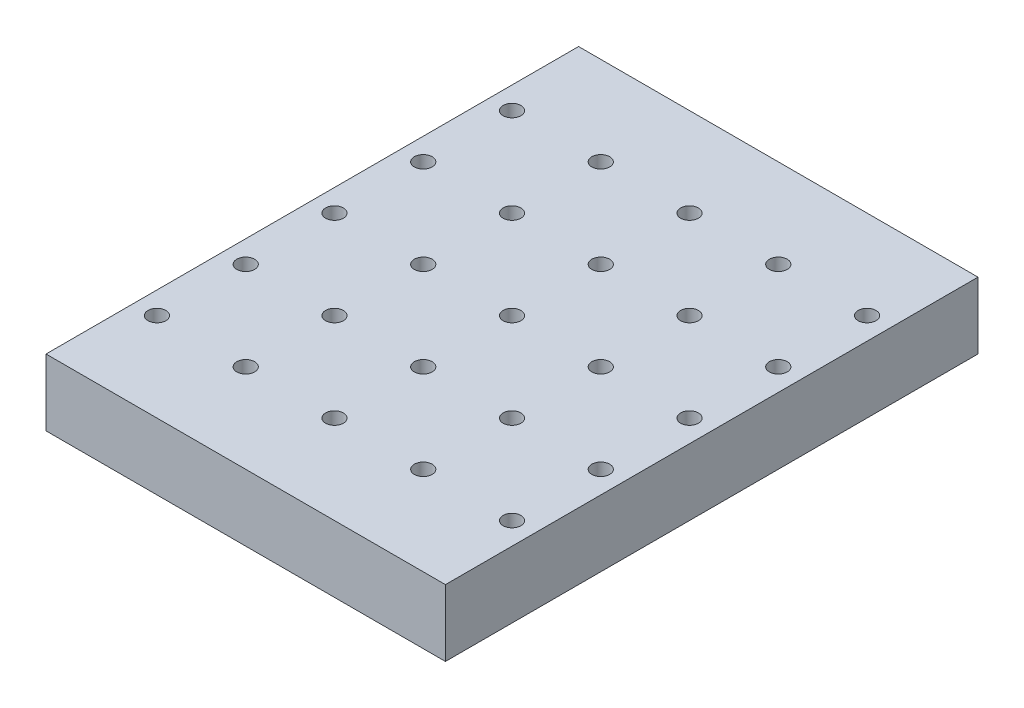
from build123d import *

# Parameters (mm, degrees)
SKETCH1_W               = 114.3
SKETCH1_H               = 152.4
BOSS_EXTRUDE1_DEPTH     = 19.05
F_1_4_20_TAPPED_HOLE1_D = 5.1054
LPATTERN1_COUNT         = 3
LPATTERN1_PITCH         = 25.4
LPATTERN1_COL_COUNT     = 3
LPATTERN1_COL_PITCH     = 25.4
LPATTERN2_COUNT         = 3
LPATTERN2_PITCH         = 25.4
LPATTERN2_COPY_1_D      = 5.1054
LPATTERN2_COPY_2_D      = 5.1054
LPATTERN2_COPY_3_D      = 5.1054
LPATTERN2_COPY_4_D      = 5.1054
LPATTERN2_COPY_5_D      = 5.1054
LPATTERN2_COPY_6_D      = 5.1054
LPATTERN2_COPY_7_D      = 5.1054
LPATTERN2_COPY_8_D      = 5.1054
LPATTERN2_COL_COUNT     = 3
LPATTERN2_COL_PITCH     = 25.4
LPATTERN2_COL_COPY_1_D  = 5.1054
LPATTERN2_COL_COPY_2_D  = 5.1054
LPATTERN2_COL_COPY_3_D  = 5.1054
LPATTERN2_COL_COPY_4_D  = 5.1054
LPATTERN2_COL_COPY_5_D  = 5.1054
LPATTERN2_COL_COPY_6_D  = 5.1054
LPATTERN2_COL_COPY_7_D  = 5.1054
LPATTERN2_COL_COPY_8_D  = 5.1054


with BuildPart() as part:
    # Sketch1 → Boss-Extrude1 (new body)
    with BuildSketch(Plane(origin=(0, 0, 0), x_dir=(1, 0, 0), z_dir=(0, 1, 0))):
        Rectangle(SKETCH1_W, SKETCH1_H)
    extrude(amount=BOSS_EXTRUDE1_DEPTH)

    # 1/4-20 Tapped Hole1 (through all)
    with Locations(Plane(origin=(0, 19.05, 0), x_dir=(1, 0, 0), z_dir=(0, 1, 0))):
        with Locations((0, 0)):
            f_1_4_20_tapped_hole1 = Hole(F_1_4_20_TAPPED_HOLE1_D / 2)

    # LPattern1: 1/4-20 Tapped Hole1 ×3
    with Locations(*[(0, 0, i * LPATTERN1_PITCH) for i in range(1, LPATTERN1_COUNT)]):
        add(f_1_4_20_tapped_hole1, mode=Mode.SUBTRACT)

    # LPattern1 col: 1/4-20 Tapped Hole1 ×3
    with Locations(*[(0, 0, -i * LPATTERN1_COL_PITCH) for i in range(1, LPATTERN1_COL_COUNT)]):
        add(f_1_4_20_tapped_hole1, mode=Mode.SUBTRACT)

    # LPattern2: 1/4-20 Tapped Hole1 ×3
    with Locations(*[(i * LPATTERN2_PITCH, 0, 0) for i in range(1, LPATTERN2_COUNT)]):
        add(f_1_4_20_tapped_hole1, mode=Mode.SUBTRACT)

    # LPattern2 copy 1 (through all)
    with Locations(Plane(origin=(25.4, 19.05, 25.4), x_dir=(1, 0, 0), z_dir=(0, 1, 0))):
        with Locations((0, 0)):
            Hole(LPATTERN2_COPY_1_D / 2)

    # LPattern2 copy 2 (through all)
    with Locations(Plane(origin=(50.8, 19.05, 25.4), x_dir=(1, 0, 0), z_dir=(0, 1, 0))):
        with Locations((0, 0)):
            Hole(LPATTERN2_COPY_2_D / 2)

    # LPattern2 copy 3 (through all)
    with Locations(Plane(origin=(25.4, 19.05, 50.8), x_dir=(1, 0, 0), z_dir=(0, 1, 0))):
        with Locations((0, 0)):
            Hole(LPATTERN2_COPY_3_D / 2)

    # LPattern2 copy 4 (through all)
    with Locations(Plane(origin=(50.8, 19.05, 50.8), x_dir=(1, 0, 0), z_dir=(0, 1, 0))):
        with Locations((0, 0)):
            Hole(LPATTERN2_COPY_4_D / 2)

    # LPattern2 copy 5 (through all)
    with Locations(Plane(origin=(25.4, 19.05, -25.4), x_dir=(1, 0, 0), z_dir=(0, 1, 0))):
        with Locations((0, 0)):
            Hole(LPATTERN2_COPY_5_D / 2)

    # LPattern2 copy 6 (through all)
    with Locations(Plane(origin=(50.8, 19.05, -25.4), x_dir=(1, 0, 0), z_dir=(0, 1, 0))):
        with Locations((0, 0)):
            Hole(LPATTERN2_COPY_6_D / 2)

    # LPattern2 copy 7 (through all)
    with Locations(Plane(origin=(25.4, 19.05, -50.8), x_dir=(1, 0, 0), z_dir=(0, 1, 0))):
        with Locations((0, 0)):
            Hole(LPATTERN2_COPY_7_D / 2)

    # LPattern2 copy 8 (through all)
    with Locations(Plane(origin=(50.8, 19.05, -50.8), x_dir=(1, 0, 0), z_dir=(0, 1, 0))):
        with Locations((0, 0)):
            Hole(LPATTERN2_COPY_8_D / 2)

    # LPattern2 col: 1/4-20 Tapped Hole1 ×3
    with Locations(*[(-i * LPATTERN2_COL_PITCH, 0, 0) for i in range(1, LPATTERN2_COL_COUNT)]):
        add(f_1_4_20_tapped_hole1, mode=Mode.SUBTRACT)

    # LPattern2 col copy 1 (through all)
    with Locations(Plane(origin=(-25.4, 19.05, 25.4), x_dir=(1, 0, 0), z_dir=(0, 1, 0))):
        with Locations((0, 0)):
            Hole(LPATTERN2_COL_COPY_1_D / 2)

    # LPattern2 col copy 2 (through all)
    with Locations(Plane(origin=(-50.8, 19.05, 25.4), x_dir=(1, 0, 0), z_dir=(0, 1, 0))):
        with Locations((0, 0)):
            Hole(LPATTERN2_COL_COPY_2_D / 2)

    # LPattern2 col copy 3 (through all)
    with Locations(Plane(origin=(-25.4, 19.05, 50.8), x_dir=(1, 0, 0), z_dir=(0, 1, 0))):
        with Locations((0, 0)):
            Hole(LPATTERN2_COL_COPY_3_D / 2)

    # LPattern2 col copy 4 (through all)
    with Locations(Plane(origin=(-50.8, 19.05, 50.8), x_dir=(1, 0, 0), z_dir=(0, 1, 0))):
        with Locations((0, 0)):
            Hole(LPATTERN2_COL_COPY_4_D / 2)

    # LPattern2 col copy 5 (through all)
    with Locations(Plane(origin=(-25.4, 19.05, -25.4), x_dir=(1, 0, 0), z_dir=(0, 1, 0))):
        with Locations((0, 0)):
            Hole(LPATTERN2_COL_COPY_5_D / 2)

    # LPattern2 col copy 6 (through all)
    with Locations(Plane(origin=(-50.8, 19.05, -25.4), x_dir=(1, 0, 0), z_dir=(0, 1, 0))):
        with Locations((0, 0)):
            Hole(LPATTERN2_COL_COPY_6_D / 2)

    # LPattern2 col copy 7 (through all)
    with Locations(Plane(origin=(-25.4, 19.05, -50.8), x_dir=(1, 0, 0), z_dir=(0, 1, 0))):
        with Locations((0, 0)):
            Hole(LPATTERN2_COL_COPY_7_D / 2)

    # LPattern2 col copy 8 (through all)
    with Locations(Plane(origin=(-50.8, 19.05, -50.8), x_dir=(1, 0, 0), z_dir=(0, 1, 0))):
        with Locations((0, 0)):
            Hole(LPATTERN2_COL_COPY_8_D / 2)


solid = part.part
